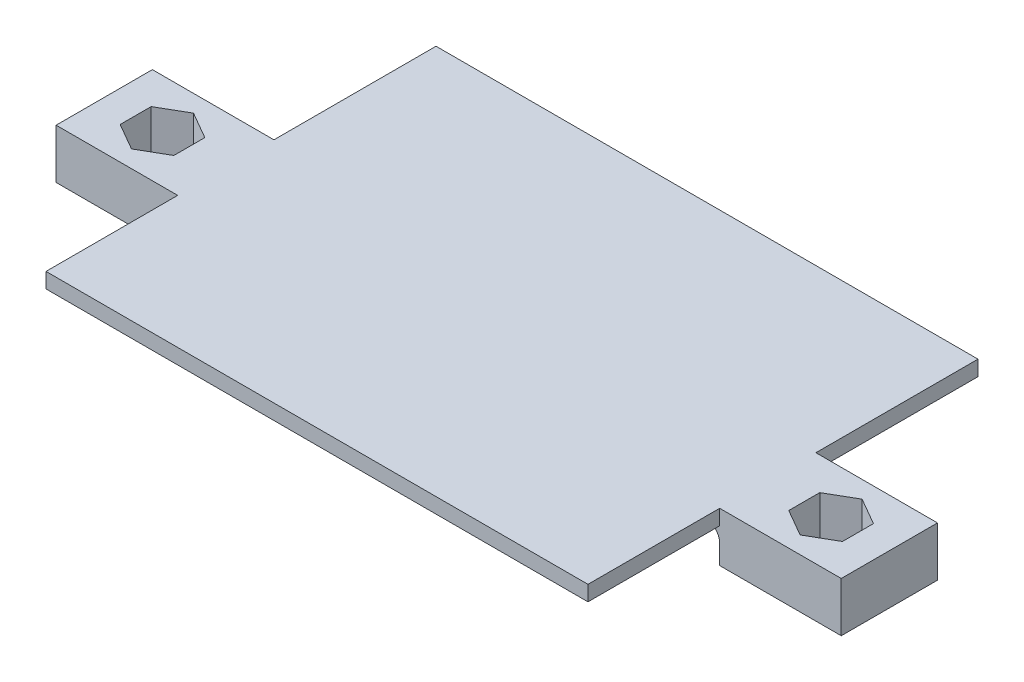
from build123d import *

# Parameters (mm, degrees)
SKETCH1_W           = 53.5
SKETCH1_H           = 38.5
BOSS_EXTRUDE1_DEPTH = 1.5
SKETCH2_W           = 12
SKETCH2_H           = 9.5
BOSS_EXTRUDE2_DEPTH = 4.9
FILLET1_R           = 1.5


with BuildPart() as part:
    # Sketch1 → Boss-Extrude1 (new body)
    with BuildSketch(Plane(origin=(0, 0, 0), x_dir=(1, 0, 0), z_dir=(0, 1, 0))):
        Rectangle(SKETCH1_W, SKETCH1_H)
    extrude(amount=-BOSS_EXTRUDE1_DEPTH)

    # Sketch2 → Boss-Extrude2 (add)
    # profile 1 of 2: a face of its own
    with BuildSketch(Plane(origin=(0, 0, 0), x_dir=(1, 0, 0), z_dir=(0, 1, 0))):
        with Locations((-32.75, -1.5)):
            Rectangle(SKETCH2_W, SKETCH2_H)
        Polygon((-33, -4.559956427), (-30.35, -3.029978213), (-30.35, 0.029978213), (-33, 1.559956427), (-35.65, 0.029978213), (-35.65, -3.029978213), align=None, mode=Mode.SUBTRACT)
    # profile 2 of 2: a face of its own
    with BuildSketch(Plane(origin=(0, 0, 0), x_dir=(1, 0, 0), z_dir=(0, 1, 0))):
        with Locations((32.75, -1.5)):
            Rectangle(SKETCH2_W, SKETCH2_H)
        Polygon((35.65, -3.029978213), (33, -4.559956427), (30.35, -3.029978213), (30.35, 0.029978213), (33, 1.559956427), (35.65, 0.029978213), align=None, mode=Mode.SUBTRACT)
    extrude(amount=-BOSS_EXTRUDE2_DEPTH)

    # Fillet1
    fillet1_edges = [part.edges().sort_by_distance(p)[0] for p in [
        (-26.75, -1.5, 1.5),
        (26.75, -1.5, 1.5),
    ]]
    fillet(fillet1_edges, radius=FILLET1_R)


solid = part.part
